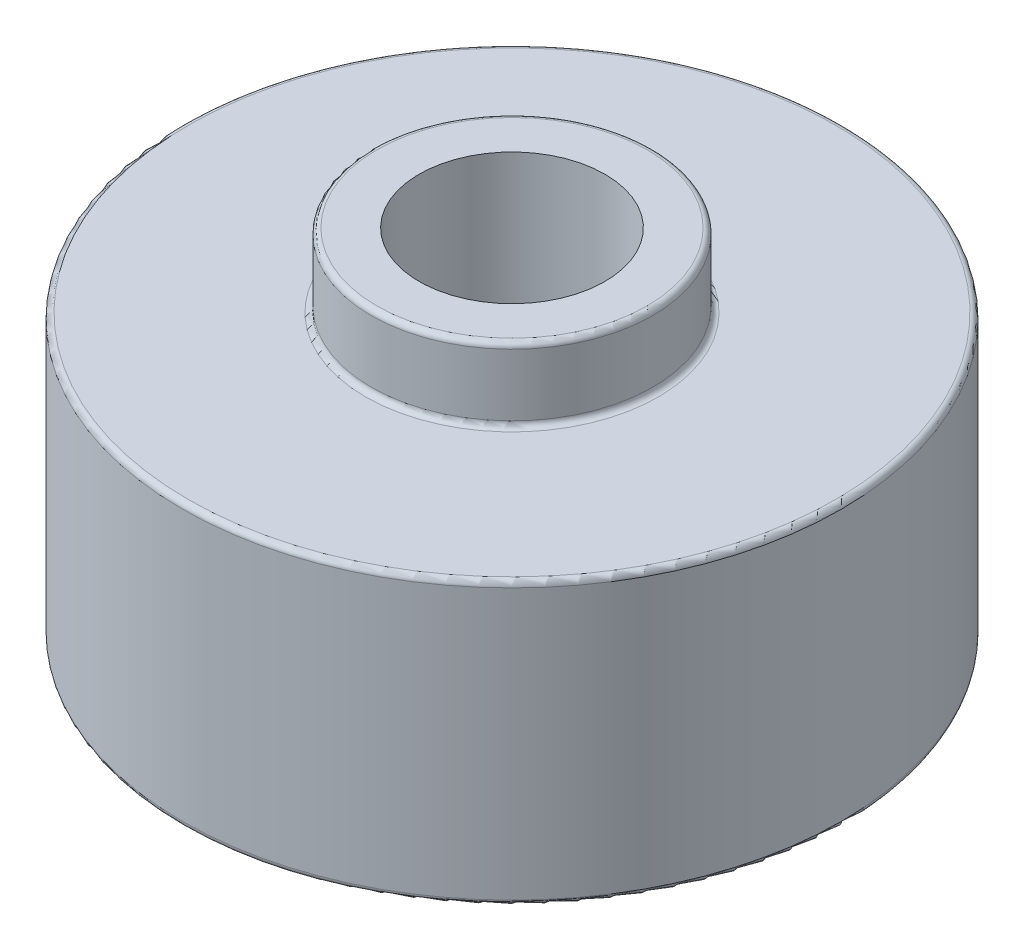
from build123d import *

# Parameters (mm, degrees)
FILLET2_R = 0.254


with BuildPart() as part:
    # Sketch1 → Revolve1 (revolve)
    with BuildSketch(Plane.XY):
        Polygon((2.159, 0), (2.159, 16.002), (0, 16.002), (0, 12.7), (-8.509, 12.7), (-8.509, 0), align=None)
    revolve(axis=Axis((6.35, 0, 0), (0, 1, 0)))

    # Fillet2
    fillet2_edges = [part.edges().sort_by_distance(p)[0] for p in [
        (21.209, 0, 0),
        (21.209, 12.7, 0),
        (12.7, 12.7, 0),
        (12.7, 16.002, 0),
    ]]
    fillet(fillet2_edges, radius=FILLET2_R)


solid = part.part
